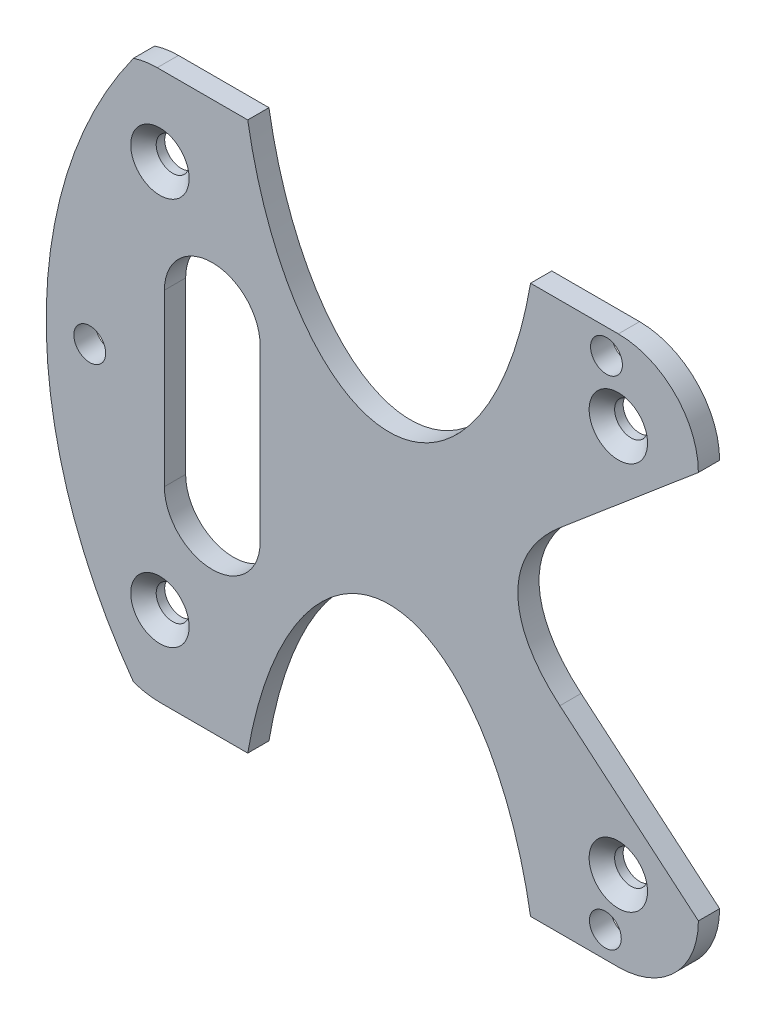
from build123d import *
from build123d.topology import SkipClean

# Parameters (mm, degrees)
BOSS_EXTRU_1_DEPTH                         = 2
FRAISAGE_POUR_VIS_T_TE_FRAIS_E_BOM_2_COUNT = 2
FRAISAGE_POUR_VIS_T_TE_FRAIS_E_BOM_2_PITCH = 36.576
FRAISAGE_POUR_VIS_T_TE_FRAIS_E_BOM_3_COUNT = 2
FRAISAGE_POUR_VIS_T_TE_FRAIS_E_BOM_3_PITCH = 56.589011089
FRAISAGE_POUR_VIS_T_TE_FRAIS_E_BOM_4_COUNT = 2
FRAISAGE_POUR_VIS_T_TE_FRAIS_E_BOM_4_PITCH = 43.18
ESQUISSE15_R                               = 1.5
ENL_V_MAT_EXTRU_5_DEPTH                    = 2
BOSS_EXTRU_3_DEPTH                         = 2
ENL_V_MAT_EXTRU_4_DEPTH                    = 2


with BuildPart() as part:
    # Esquisse1 → Boss.-Extru.1 (new body)
    with BuildSketch(Plane.XY):
        with BuildLine():
            Line((5, 2.54), (5, 39.116))
            ThreePointArc((5, 39.116), (2.79158513, 44.44758513), (-2.54, 46.656))
            Line((-2.54, 46.656), (-45.974, 46.656))
            ThreePointArc((-45.974, 46.656), (-51.125980008, 44.521980008), (-53.26, 39.37))
            Line((-53.26, 39.37), (-53.26, 2.54))
            ThreePointArc((-53.26, 2.54), (-51.05158513, -2.79158513), (-45.72, -5))
            Line((-45.72, -5), (-2.54, -5))
            ThreePointArc((-2.54, -5), (2.79158513, -2.79158513), (5, 2.54))
        make_face()
    extrude(amount=BOSS_EXTRU_1_DEPTH)

    # Esquisse16 → Fraisage pour vis à tête fraisée bombée M2.51 (revolve, cut)
    with BuildSketch(Plane(origin=(-2.54, 2.54, 2), x_dir=(0, -1, 0), z_dir=(1, 0, 0))):
        Polygon((0, 0), (0, 2), (1.55, 2), (1.55, 1.2), (2.75, 0), align=None)
    fraisage_pour_vis_t_te_frais_e_bomb_e = revolve(axis=Axis((-2.54, 2.54, 8.35), (0, 0, -1)), mode=Mode.SUBTRACT)

    # Fraisage pour vis _ t_te frais_e bom 2: Fraisage pour vis à tête fraisée bombée M2.51 ×2
    with Locations(*[(0, i * FRAISAGE_POUR_VIS_T_TE_FRAIS_E_BOM_2_PITCH, 0) for i in range(1, FRAISAGE_POUR_VIS_T_TE_FRAIS_E_BOM_2_COUNT)]):
        add(fraisage_pour_vis_t_te_frais_e_bomb_e, mode=Mode.SUBTRACT)

    # Fraisage pour vis _ t_te frais_e bom 3: Fraisage pour vis à tête fraisée bombée M2.51 ×2
    with Locations(*[Vector(-0.7630456721058034, 0.6463445693131512, 0) * (i * FRAISAGE_POUR_VIS_T_TE_FRAIS_E_BOM_3_PITCH) for i in range(1, FRAISAGE_POUR_VIS_T_TE_FRAIS_E_BOM_3_COUNT)]):
        add(fraisage_pour_vis_t_te_frais_e_bomb_e, mode=Mode.SUBTRACT)

    # Fraisage pour vis _ t_te frais_e bom 4: Fraisage pour vis à tête fraisée bombée M2.51 ×2
    with Locations(*[(-i * FRAISAGE_POUR_VIS_T_TE_FRAIS_E_BOM_4_PITCH, 0, 0) for i in range(1, FRAISAGE_POUR_VIS_T_TE_FRAIS_E_BOM_4_COUNT)]):
        add(fraisage_pour_vis_t_te_frais_e_bomb_e, mode=Mode.SUBTRACT)

    # Esquisse15 → Enlèv. mat.-Extru.5 (cut)
    with BuildSketch(Plane.XY):
        with Locations((-3.658386169, 44.310446006)):
            Circle(ESQUISSE15_R)
        with Locations((-52.330547462, 20.925047052)):
            Circle(ESQUISSE15_R)
        with Locations((-3.763486561, -2.551663742)):
            Circle(ESQUISSE15_R)
    extrude(amount=ENL_V_MAT_EXTRU_5_DEPTH, mode=Mode.SUBTRACT)

    # Esquisse14 → Boss.-Extru.3 (add)
    with BuildSketch(Plane.XY):
        with BuildLine():
            Line((-53.26, 22.10238217), (-53.26, 37.165169918))
            ThreePointArc((-53.26, 37.165169918), (-53.588975101, 36.32688135), (-53.900520078, 35.481960013))
            ThreePointArc((-53.900520078, 35.481960013), (-56.432053148, 20.831365998), (-53.880132923, 6.184309371))
            ThreePointArc((-53.880132923, 6.184309371), (-53.578203562, 5.368091645), (-53.26, 4.558079787))
            Line((-53.26, 4.558079787), (-53.26, 19.747711934))
            ThreePointArc((-53.26, 19.747711934), (-53.830547462, 20.925047052), (-53.26, 22.10238217))
        make_face()
    extrude(amount=BOSS_EXTRU_3_DEPTH)

    # Esquisse14<5> → Enlèv. mat.-Extru.4 (cut)
    with SkipClean():  # the faces are left unmerged after this step: merging them gives an invalid solid
        with BuildSketch(Plane.XY):
            with BuildLine():
                ThreePointArc((-53.26, 37.165169918), (-51.011337475, 41.886482774), (-48.212169147, 46.303714363))
                ThreePointArc((-48.212169147, 46.303714363), (-51.69919041, 43.876438812), (-53.239451379, 39.916820138))
                Line((-53.239451379, 39.916820138), (-53.900520078, 35.481960013))
                ThreePointArc((-53.900520078, 35.481960013), (-53.588975101, 36.32688135), (-53.26, 37.165169918))
            make_face()
            with BuildLine():
                add(Edge.make_bspline(
                    [(-37.449667929, 46.656), (-24.13, -31.756310028), (-10.810332071, 46.656)],
                    knots=[5.033406034, 5.033406034, 5.033406034, 7.53296458, 7.53296458, 7.53296458], degree=2, weights=[1, 0.315531822, 1]))
                Line((-10.810332071, 46.656), (-37.449667929, 46.656))
            make_face()
            with BuildLine():
                Line((-37.449667929, -5), (-10.810332071, -5))
                add(Edge.make_bspline(
                    [(-10.810332071, -5), (-24.13, 73.412310028), (-37.449667929, -5)],
                    knots=[5.033406034, 5.033406034, 5.033406034, 7.53296458, 7.53296458, 7.53296458], degree=2, weights=[1, 0.315531822, 1]))
            make_face()
            with BuildLine():
                ThreePointArc((-53.210302169, 1.675723757), (-51.610678888, -2.166538244), (-48.2162601, -4.574793427))
                ThreePointArc((-48.2162601, -4.574793427), (-51.013027883, -0.160172479), (-53.26, 4.558079787))
                ThreePointArc((-53.26, 4.558079787), (-53.578203562, 5.368091645), (-53.880132923, 6.184309371))
                Line((-53.880132923, 6.184309371), (-53.210302169, 1.675723757))
            make_face()
            with BuildLine():
                Line((-36.280356092, 12.815116729), (-36.280356092, 28.840883271))
                ThreePointArc((-36.280356092, 28.840883271), (-40.789570049, 33.350097228), (-45.298784007, 28.840883271))
                Line((-45.298784007, 28.840883271), (-45.298784007, 12.815116729))
                ThreePointArc((-45.298784007, 12.815116729), (-40.789570049, 8.305902772), (-36.280356092, 12.815116729))
            make_face()
            with BuildLine():
                Line((5, 39.116), (-8.045410448, 28.091494556))
                add(Edge.make_bspline(
                    [(-8.045410448, 28.091494556), (-16.636453297, 20.831316808), (-8.047692631, 13.570434437)],
                    knots=[5.739468015, 5.739468015, 5.739468015, 6.826742025, 6.826742025, 6.826742025], degree=2, weights=[1, 0.855833098, 1]))
                Line((-8.047692631, 13.570434437), (5, 2.54))
                Line((5, 2.54), (5, 39.116))
            make_face()
        extrude(amount=ENL_V_MAT_EXTRU_4_DEPTH, mode=Mode.SUBTRACT)


solid = part.part
